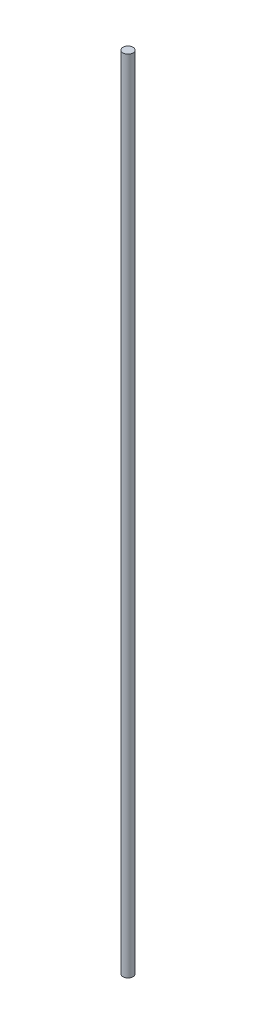
from build123d import *

# Parameters (mm, degrees)
SKETCH1_R           = 2.5
BOSS_EXTRUDE1_DEPTH = 400


with BuildPart() as part:
    # Sketch1 → Boss-Extrude1 (new body)
    with BuildSketch(Plane(origin=(0, 0, 0), x_dir=(1, 0, 0), z_dir=(0, 1, 0))):
        with Locations(Location((0, 0, 0), (0, 0, 270))):
            Circle(SKETCH1_R)
    extrude(amount=BOSS_EXTRUDE1_DEPTH)


solid = part.part
